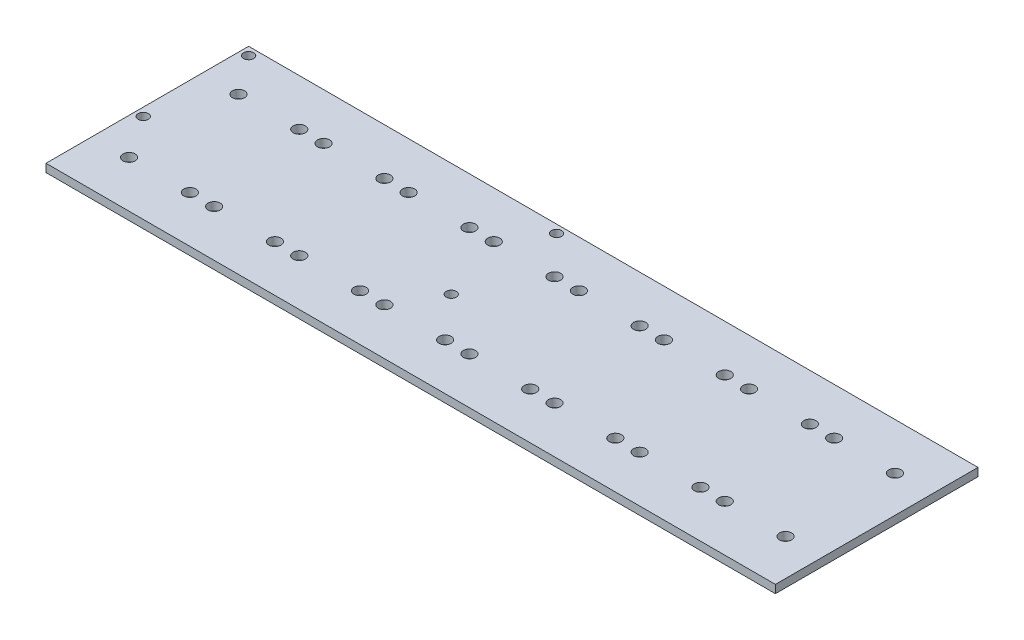
from build123d import *

# Parameters (mm, degrees)
SKETCH_1_W      = 180
SKETCH_1_H      = 50
SKETCH_1_R      = 1.5
SKETCH_1_R_2    = 1.25
EXTRUDE_1_DEPTH = 2


with BuildPart() as part:
    # 草图1 → 凸台-拉伸1 (new body)
    with BuildSketch(Plane(origin=(0, 0, 0), x_dir=(1, 0, 0), z_dir=(0, 1, 0))):
        with Locations((90, -25)):
            Rectangle(SKETCH_1_W, SKETCH_1_H)
        with Locations(Location((9, -11.5, 0), (0, 0, 270))):
            Circle(SKETCH_1_R, mode=Mode.SUBTRACT)
        with Locations(Location((9, -38.5, 0), (0, 0, 270))):
            Circle(SKETCH_1_R, mode=Mode.SUBTRACT)
        with Locations(Location((24, -11.5, 0), (0, 0, 270))):
            Circle(SKETCH_1_R, mode=Mode.SUBTRACT)
        with Locations(Location((24, -38.5, 0), (0, 0, 270))):
            Circle(SKETCH_1_R, mode=Mode.SUBTRACT)
        with Locations(Location((30, -38.5, 0), (0, 0, 270))):
            Circle(SKETCH_1_R, mode=Mode.SUBTRACT)
        with Locations(Location((45, -38.5, 0), (0, 0, 270))):
            Circle(SKETCH_1_R, mode=Mode.SUBTRACT)
        with Locations(Location((45, -11.5, 0), (0, 0, 270))):
            Circle(SKETCH_1_R, mode=Mode.SUBTRACT)
        with Locations(Location((30, -11.5, 0), (0, 0, 270))):
            Circle(SKETCH_1_R, mode=Mode.SUBTRACT)
        with Locations(Location((51, -38.5, 0), (0, 0, 270))):
            Circle(SKETCH_1_R, mode=Mode.SUBTRACT)
        with Locations(Location((66, -38.5, 0), (0, 0, 270))):
            Circle(SKETCH_1_R, mode=Mode.SUBTRACT)
        with Locations(Location((66, -11.5, 0), (0, 0, 270))):
            Circle(SKETCH_1_R, mode=Mode.SUBTRACT)
        with Locations(Location((51, -11.5, 0), (0, 0, 270))):
            Circle(SKETCH_1_R, mode=Mode.SUBTRACT)
        with Locations(Location((72, -38.5, 0), (0, 0, 270))):
            Circle(SKETCH_1_R, mode=Mode.SUBTRACT)
        with Locations(Location((87, -38.5, 0), (0, 0, 270))):
            Circle(SKETCH_1_R, mode=Mode.SUBTRACT)
        with Locations(Location((87, -11.5, 0), (0, 0, 270))):
            Circle(SKETCH_1_R, mode=Mode.SUBTRACT)
        with Locations(Location((72, -11.5, 0), (0, 0, 270))):
            Circle(SKETCH_1_R, mode=Mode.SUBTRACT)
        with Locations(Location((93, -38.5, 0), (0, 0, 270))):
            Circle(SKETCH_1_R, mode=Mode.SUBTRACT)
        with Locations(Location((108, -38.5, 0), (0, 0, 270))):
            Circle(SKETCH_1_R, mode=Mode.SUBTRACT)
        with Locations(Location((108, -11.5, 0), (0, 0, 270))):
            Circle(SKETCH_1_R, mode=Mode.SUBTRACT)
        with Locations(Location((93, -11.5, 0), (0, 0, 270))):
            Circle(SKETCH_1_R, mode=Mode.SUBTRACT)
        with Locations(Location((114, -38.5, 0), (0, 0, 270))):
            Circle(SKETCH_1_R, mode=Mode.SUBTRACT)
        with Locations(Location((129, -38.5, 0), (0, 0, 270))):
            Circle(SKETCH_1_R, mode=Mode.SUBTRACT)
        with Locations(Location((129, -11.5, 0), (0, 0, 270))):
            Circle(SKETCH_1_R, mode=Mode.SUBTRACT)
        with Locations(Location((114, -11.5, 0), (0, 0, 270))):
            Circle(SKETCH_1_R, mode=Mode.SUBTRACT)
        with Locations(Location((135, -38.5, 0), (0, 0, 270))):
            Circle(SKETCH_1_R, mode=Mode.SUBTRACT)
        with Locations(Location((150, -38.5, 0), (0, 0, 270))):
            Circle(SKETCH_1_R, mode=Mode.SUBTRACT)
        with Locations(Location((150, -11.5, 0), (0, 0, 270))):
            Circle(SKETCH_1_R, mode=Mode.SUBTRACT)
        with Locations(Location((135, -11.5, 0), (0, 0, 270))):
            Circle(SKETCH_1_R, mode=Mode.SUBTRACT)
        with Locations(Location((156, -38.5, 0), (0, 0, 270))):
            Circle(SKETCH_1_R, mode=Mode.SUBTRACT)
        with Locations(Location((171, -38.5, 0), (0, 0, 270))):
            Circle(SKETCH_1_R, mode=Mode.SUBTRACT)
        with Locations(Location((171, -11.5, 0), (0, 0, 270))):
            Circle(SKETCH_1_R, mode=Mode.SUBTRACT)
        with Locations(Location((156, -11.5, 0), (0, 0, 270))):
            Circle(SKETCH_1_R, mode=Mode.SUBTRACT)
        with Locations(Location((2, -2, 0), (0, 0, 270))):
            Circle(SKETCH_1_R_2, mode=Mode.SUBTRACT)
        with Locations(Location((78, -2, 0), (0, 0, 270))):
            Circle(SKETCH_1_R_2, mode=Mode.SUBTRACT)
        with Locations(Location((2, -28, 0), (0, 0, 270))):
            Circle(SKETCH_1_R_2, mode=Mode.SUBTRACT)
        with Locations(Location((78, -28, 0), (0, 0, 270))):
            Circle(SKETCH_1_R_2, mode=Mode.SUBTRACT)
    extrude(amount=EXTRUDE_1_DEPTH)


solid = part.part
